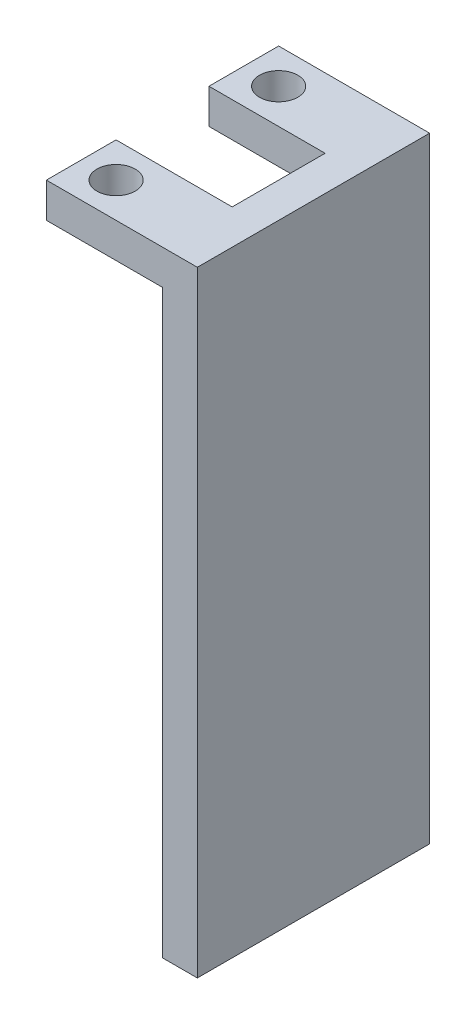
from build123d import *

# Parameters (mm, degrees)
SKETCH1_W           = 20
SKETCH1_H           = 53
BOSS_EXTRUDE1_DEPTH = 3
SKETCH2_W           = 6
SKETCH2_H           = 3
BOSS_EXTRUDE2_DEPTH = 10
CUT_EXTRUDE1_REACH  = 53.962
SKETCH4_R           = 1.65


with BuildPart() as part:
    # Sketch1 → Boss-Extrude1 (new body)
    with BuildSketch(Plane(origin=(0, 0, 0), x_dir=(0, 0, -1), z_dir=(1, 0, 0))):
        Rectangle(SKETCH1_W, SKETCH1_H)
    extrude(amount=BOSS_EXTRUDE1_DEPTH)

    # Sketch2 → Boss-Extrude2 (add)
    with BuildSketch(Plane.ZY):
        with Locations((-7, 25)):
            Rectangle(SKETCH2_W, SKETCH2_H)
        with Locations((7, 25)):
            Rectangle(SKETCH2_W, SKETCH2_H)
    extrude(amount=BOSS_EXTRUDE2_DEPTH)

    # Sketch4 → Cut-Extrude1 (cut, up to next)
    with BuildSketch(Plane.XZ.offset(-23.5), mode=Mode.PRIVATE) as cut_extrude1_sk1:
        with Locations(Location((-7, 7, 0), (0, 0, 270))):
            Circle(SKETCH4_R)
    cut_extrude1_tool1 = extrude(cut_extrude1_sk1.sketch, amount=-CUT_EXTRUDE1_REACH, mode=Mode.PRIVATE) & part.part
    # Sketch4 → Cut-Extrude1 (cut, up to next)
    with BuildSketch(Plane.XZ.offset(-23.5), mode=Mode.PRIVATE) as cut_extrude1_sk2:
        with Locations(Location((-7, -7, 0), (0, 0, 270))):
            Circle(SKETCH4_R)
    cut_extrude1_tool2 = extrude(cut_extrude1_sk2.sketch, amount=-CUT_EXTRUDE1_REACH, mode=Mode.PRIVATE) & part.part
    add(cut_extrude1_tool1.solids().sort_by_distance((-7, 23.5, 7))[0], mode=Mode.SUBTRACT)
    add(cut_extrude1_tool2.solids().sort_by_distance((-7, 23.5, -7))[0], mode=Mode.SUBTRACT)


solid = part.part
